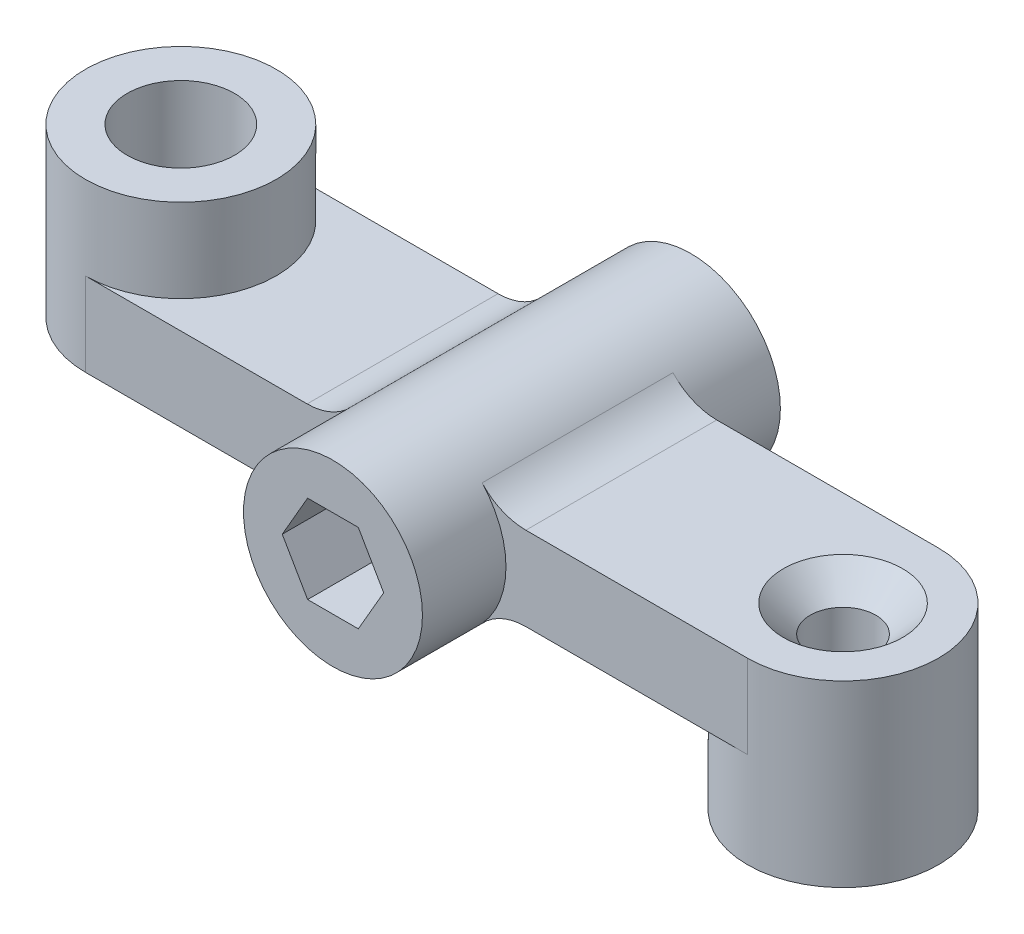
from build123d import *

# Parameters (mm, degrees)
SKETCH1_W                                        = 111
SKETCH1_H                                        = 32
BOSS_EXTRUDE1_DEPTH                              = 14
BOSS_EXTRUDE2_DEPTH                              = 28
BOSS_EXTRUDE3_DEPTH                              = 14
BOSS_EXTRUDE3_DEPTH_BACK                         = 16
SKETCH1_4_R                                      = 16
F_18_0_18_DIAMETER_HOLE1_D                       = 18
CSK_FOR_M10_FLAT_HEAD_MACHINE_SCREW1_D           = 11
CSK_FOR_M10_FLAT_HEAD_MACHINE_SCREW1_CSINK_D     = 20
CSK_FOR_M10_FLAT_HEAD_MACHINE_SCREW1_CSINK_ANGLE = 90
BOSS_EXTRUDE5_DEPTH                              = 14
BOSS_EXTRUDE5_DEPTH_BACK                         = 46
SKETCH4_R                                        = 15
CUT_EXTRUDE2_DEPTH                               = 32
FILLET1_R                                        = 10


with BuildPart() as part:
    # Sketch1 → Boss-Extrude1 (new body)
    with BuildSketch(Plane(origin=(0, 0, 0), x_dir=(1, 0, 0), z_dir=(0, 1, 0))):
        with Locations((55.5, 16)):
            Rectangle(SKETCH1_W, SKETCH1_H)
    extrude(amount=BOSS_EXTRUDE1_DEPTH)

    # Sketch1<3> → Boss-Extrude2 (add)
    with BuildSketch(Plane(origin=(0, 0, 0), x_dir=(1, 0, 0), z_dir=(0, 1, 0))):
        with BuildLine():
            ThreePointArc((0, 32), (-16, 16), (0, 0))
            Line((0, 0), (0, 32))
        make_face()
        with BuildLine():
            Line((0, 32), (0, 0))
            ThreePointArc((0, 0), (11.313708499, 4.686291501), (16, 16))
            ThreePointArc((16, 16), (11.313708499, 27.313708499), (0, 32))
        make_face()
    extrude(amount=BOSS_EXTRUDE2_DEPTH)

    # Sketch1<4> → Boss-Extrude3 (add, two sides: drawn at the far end of the back side and taken through both)
    with BuildSketch(Plane(origin=(0, 0, 0), x_dir=(1, 0, 0), z_dir=(0, 1, 0)).offset(-BOSS_EXTRUDE3_DEPTH_BACK)):
        with Locations(Location((111, 16, 0), (0, 0, 270))):
            Circle(SKETCH1_4_R)
    extrude(amount=BOSS_EXTRUDE3_DEPTH + BOSS_EXTRUDE3_DEPTH_BACK)

    # Ø18.0 (18) Diameter Hole1 (through all)
    with Locations(Plane(origin=(0, 28, -16), x_dir=(0, 0, 1), z_dir=(0, 1, 0))):
        with Locations((0, 0)):
            Hole(F_18_0_18_DIAMETER_HOLE1_D / 2)

    # CSK for M10 Flat Head Machine Screw1 (through all)
    with Locations(Plane(origin=(111, 14, -16), x_dir=(0, 0, 1), z_dir=(0, 1, 0))):
        with Locations((0, 0)):
            CounterSinkHole(CSK_FOR_M10_FLAT_HEAD_MACHINE_SCREW1_D / 2, CSK_FOR_M10_FLAT_HEAD_MACHINE_SCREW1_CSINK_D / 2, counter_sink_angle=CSK_FOR_M10_FLAT_HEAD_MACHINE_SCREW1_CSINK_ANGLE)

    # Sketch4 → Boss-Extrude5 (add, two sides: drawn at the far end of the back side and taken through both)
    with BuildSketch(Plane.XY.offset(-BOSS_EXTRUDE5_DEPTH_BACK)):
        with Locations((55.5, 7)):
            Circle(SKETCH4_R)
        Polygon((64, 7), (59.75, 14.361215932), (51.25, 14.361215932), (47, 7), (51.25, -0.361215932), (59.75, -0.361215932), align=None, mode=Mode.SUBTRACT)
    extrude(amount=BOSS_EXTRUDE5_DEPTH + BOSS_EXTRUDE5_DEPTH_BACK)

    # Sketch4<3> → Cut-Extrude2 (cut)
    with BuildSketch(Plane.XY):
        Polygon((59.958548116, 0), (64, 7), (59.958548116, 14), (51.041451884, 14), (47, 7), (51.041451884, 0), align=None)
    extrude(amount=-CUT_EXTRUDE2_DEPTH, mode=Mode.SUBTRACT)

    # Fillet1
    fillet1_edges = [part.edges().sort_by_distance(p)[0] for p in [
        (42.233500839, 0, -16),
        (68.766499161, 0, -16),
        (68.766499161, 14, -16),
        (42.233500839, 14, -16),
    ]]
    fillet(fillet1_edges, radius=FILLET1_R)


solid = part.part
